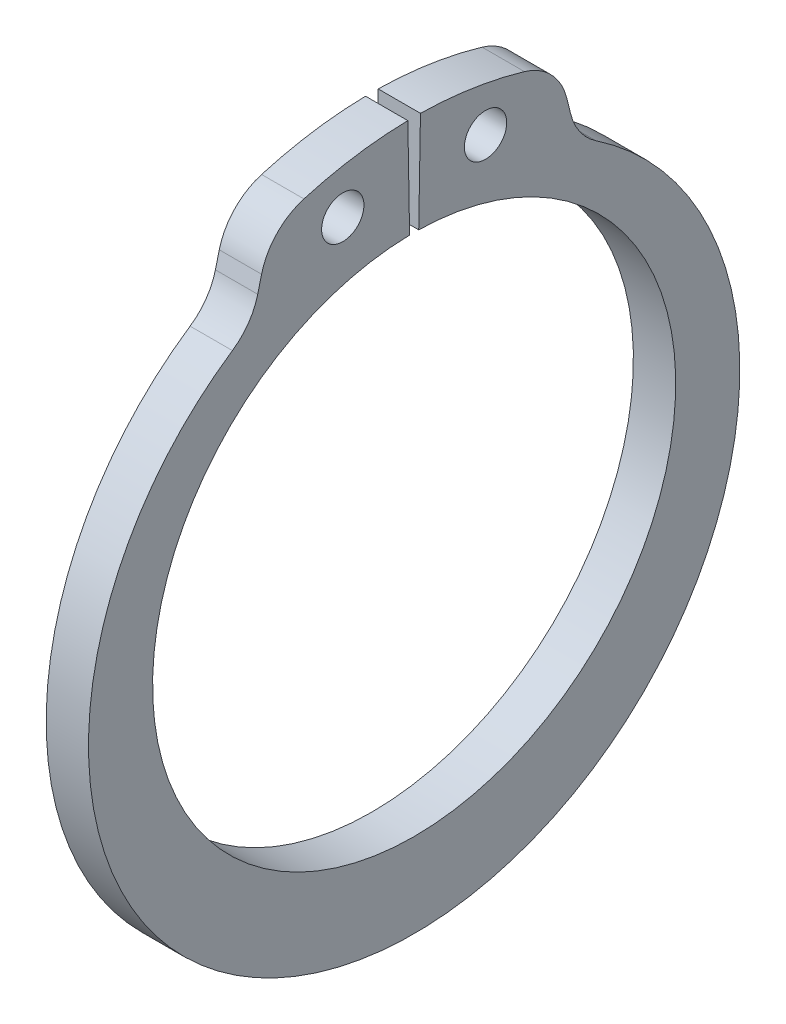
from build123d import *

# Parameters (mm, degrees)
SKETCH1_R      = 1.1811
EXTRUDE1_DEPTH = 1.1811
FILLET1_R      = 3.429


with BuildPart() as part:
    # Sketch1 → Extrude1 (new, symmetric)
    with BuildSketch(Plane(origin=(0, 0, 0), x_dir=(0, 0, -1), z_dir=(1, 0, 0))):
        with BuildLine():
            Line((-0.254892396, 14.602775588), (-0.352416443, 20.189924508))
            ThreePointArc((-0.352416443, 20.189924508), (-4.280620651, 19.766898027), (-8.070021783, 18.6487841))
            Line((-8.070021783, 18.6487841), (-9.069686411, 14.639348273))
            ThreePointArc((-9.069686411, 14.639348273), (0, -19.304), (9.069686411, 14.639348273))
            Line((9.069686411, 14.639348273), (8.070021783, 18.6487841))
            ThreePointArc((8.070021783, 18.6487841), (4.280620651, 19.766898027), (0.352416443, 20.189924508))
            Line((0.352416443, 20.189924508), (0.254892396, 14.602775588))
            ThreePointArc((0.254892396, 14.602775588), (0, -14.605), (-0.254892396, 14.602775588))
        make_face()
        with Locations((-3.986359627, 17.33206819)):
            Circle(SKETCH1_R, mode=Mode.SUBTRACT)
        with Locations((3.986359627, 17.33206819)):
            Circle(SKETCH1_R, mode=Mode.SUBTRACT)
    extrude(amount=EXTRUDE1_DEPTH, both=True)

    # Fillet1
    fillet1_edges = [part.edges().sort_by_distance(p)[0] for p in [
        (0, 18.6487841, -8.070021783),
        (0, 14.639348273, -9.069686411),
        (0, 14.639348273, 9.069686411),
        (0, 18.6487841, 8.070021783),
    ]]
    fillet(fillet1_edges, radius=FILLET1_R)


solid = part.part
